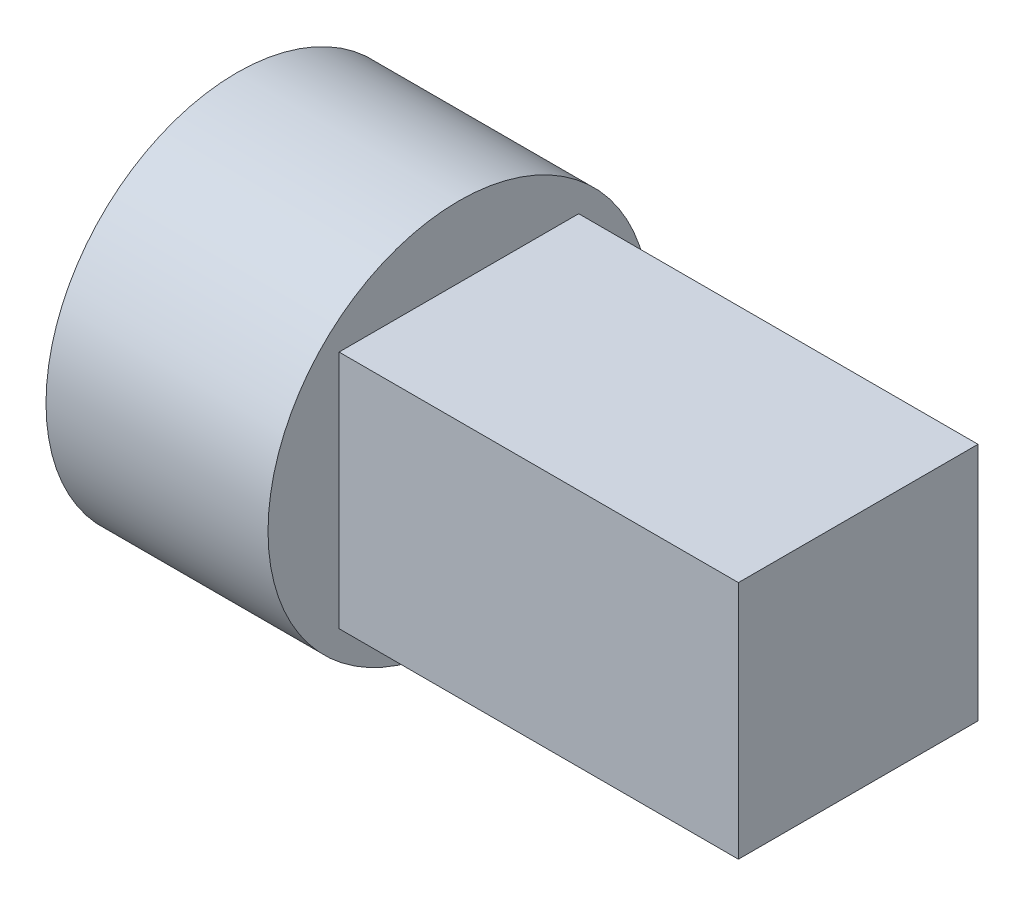
from build123d import *

# Parameters (mm, degrees)
SKETCH1_R           = 4.78
BOSS_EXTRUDE1_DEPTH = 2.78
SKETCH2_W           = 6
SKETCH2_H           = 6
BOSS_EXTRUDE2_DEPTH = 10


with BuildPart() as part:
    # Sketch1 → Boss-Extrude1 (new, symmetric)
    with BuildSketch(Plane(origin=(0, 0, 0), x_dir=(0, 0, -1), z_dir=(1, 0, 0))):
        Circle(SKETCH1_R)
    extrude(amount=BOSS_EXTRUDE1_DEPTH, both=True)

    # Sketch2 → Boss-Extrude2 (add)
    with BuildSketch(Plane(origin=(2.78, 0, 0), x_dir=(0, 0, -1), z_dir=(1, 0, 0))):
        Rectangle(SKETCH2_W, SKETCH2_H)
    extrude(amount=BOSS_EXTRUDE2_DEPTH)


solid = part.part
